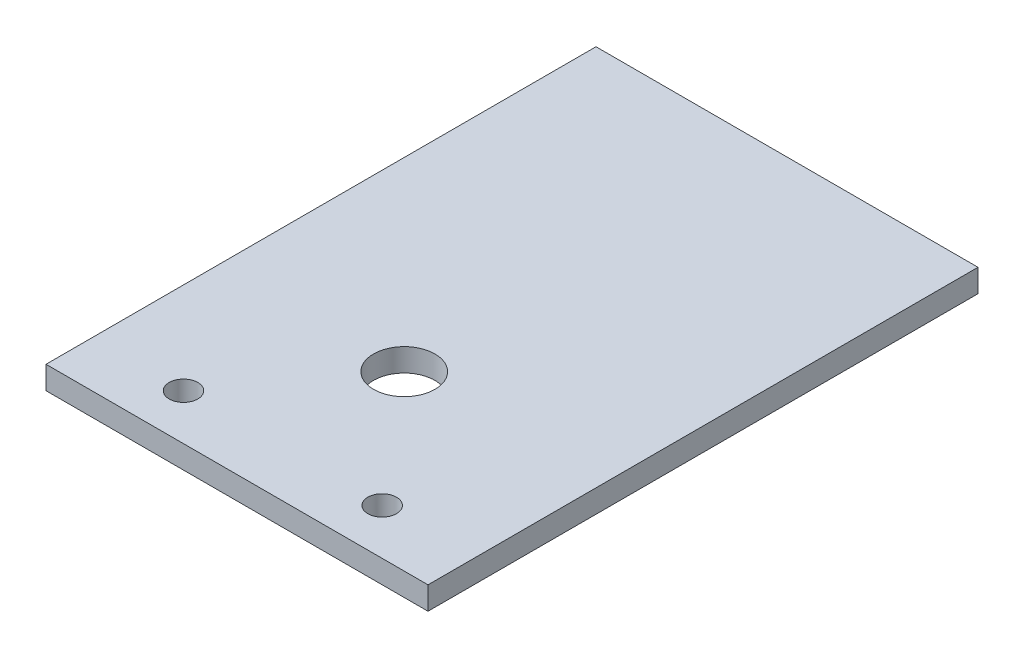
from build123d import *

# Parameters (mm, degrees)
SKETCH1_W           = 105.849999898
SKETCH1_H           = 152.4
BOSS_EXTRUDE1_DEPTH = 6.35
CUT_EXTRUDE1_REACH  = 94.994
SKETCH2_R           = 3.96875
SKETCH2_R_2         = 8.5


with BuildPart() as part:
    # Sketch1 → Boss-Extrude1 (new body)
    with BuildSketch(Plane(origin=(0, 0, 0), x_dir=(1, 0, 0), z_dir=(0, 1, 0))):
        Rectangle(SKETCH1_W, SKETCH1_H)
    extrude(amount=BOSS_EXTRUDE1_DEPTH)

    # Sketch2 → Cut-Extrude1 (cut, up to next)
    with BuildSketch(Plane(origin=(0, 6.35, 0), x_dir=(1, 0, 0), z_dir=(0, 1, 0)), mode=Mode.PRIVATE) as cut_extrude1_sk1:
        with Locations(Location((-27.524999949, -63.5, 0), (0, 0, 270))):
            Circle(SKETCH2_R)
    cut_extrude1_tool1 = extrude(cut_extrude1_sk1.sketch, amount=-CUT_EXTRUDE1_REACH, mode=Mode.PRIVATE) & part.part
    # Sketch2 → Cut-Extrude1 (cut, up to next)
    with BuildSketch(Plane(origin=(0, 6.35, 0), x_dir=(1, 0, 0), z_dir=(0, 1, 0)), mode=Mode.PRIVATE) as cut_extrude1_sk2:
        with Locations(Location((27.524999949, -63.5, 0), (0, 0, 270))):
            Circle(SKETCH2_R)
    cut_extrude1_tool2 = extrude(cut_extrude1_sk2.sketch, amount=-CUT_EXTRUDE1_REACH, mode=Mode.PRIVATE) & part.part
    # Sketch2 → Cut-Extrude1 (cut, up to next)
    with BuildSketch(Plane(origin=(0, 6.35, 0), x_dir=(1, 0, 0), z_dir=(0, 1, 0)), mode=Mode.PRIVATE) as cut_extrude1_sk3:
        with Locations(Location((-1.523999881, -28.34, 0), (0, 0, 270))):
            Circle(SKETCH2_R_2)
    cut_extrude1_tool3 = extrude(cut_extrude1_sk3.sketch, amount=-CUT_EXTRUDE1_REACH, mode=Mode.PRIVATE) & part.part
    add(cut_extrude1_tool1.solids().sort_by_distance((-27.525, 6.35, 63.5))[0], mode=Mode.SUBTRACT)
    add(cut_extrude1_tool2.solids().sort_by_distance((27.525, 6.35, 63.5))[0], mode=Mode.SUBTRACT)
    add(cut_extrude1_tool3.solids().sort_by_distance((-1.524, 6.35, 28.34))[0], mode=Mode.SUBTRACT)


solid = part.part
